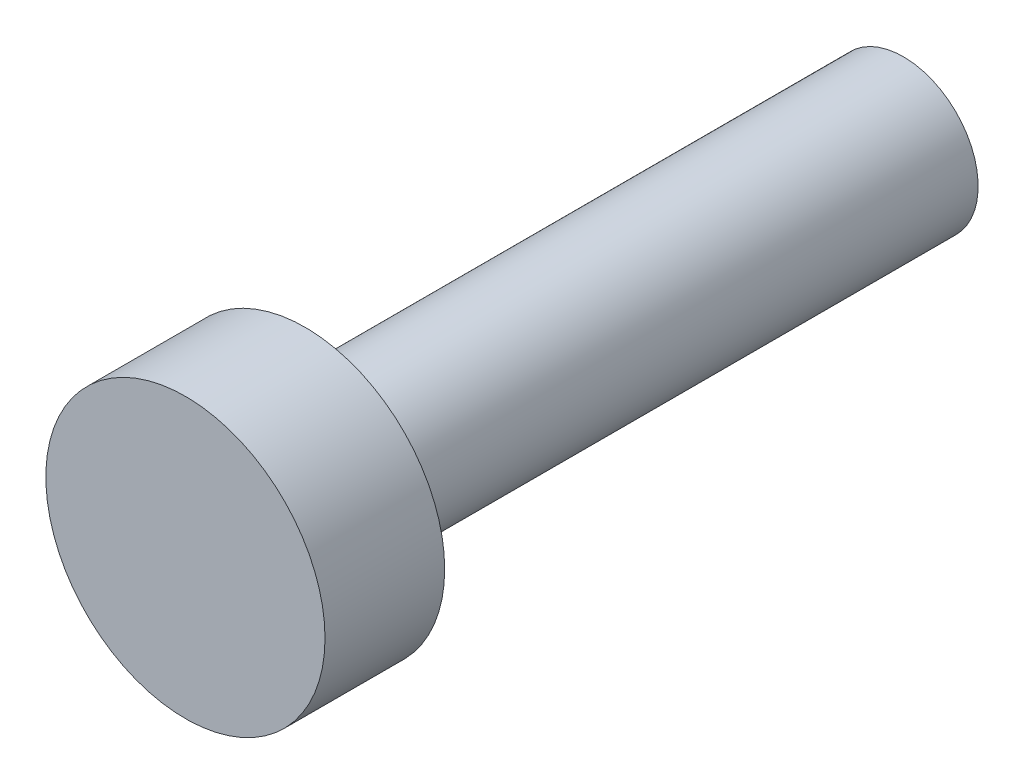
from build123d import *

# Parameters (mm, degrees)
ESQUISSE1_R        = 2.8
BOSS_EXTRU_1_DEPTH = 2.4
ESQUISSE2_R        = 1.5
BOSS_EXTRU_2_DEPTH = 12


with BuildPart() as part:
    # Esquisse1 → Boss.-Extru.1 (new body)
    with BuildSketch(Plane.XY):
        Circle(ESQUISSE1_R)
    extrude(amount=BOSS_EXTRU_1_DEPTH)

    # Esquisse2 → Boss.-Extru.2 (add)
    with BuildSketch(Plane(origin=(0, 0, 0), x_dir=(-1, 0, 0), z_dir=(0, 0, -1))):
        Circle(ESQUISSE2_R)
    extrude(amount=BOSS_EXTRU_2_DEPTH)


solid = part.part
